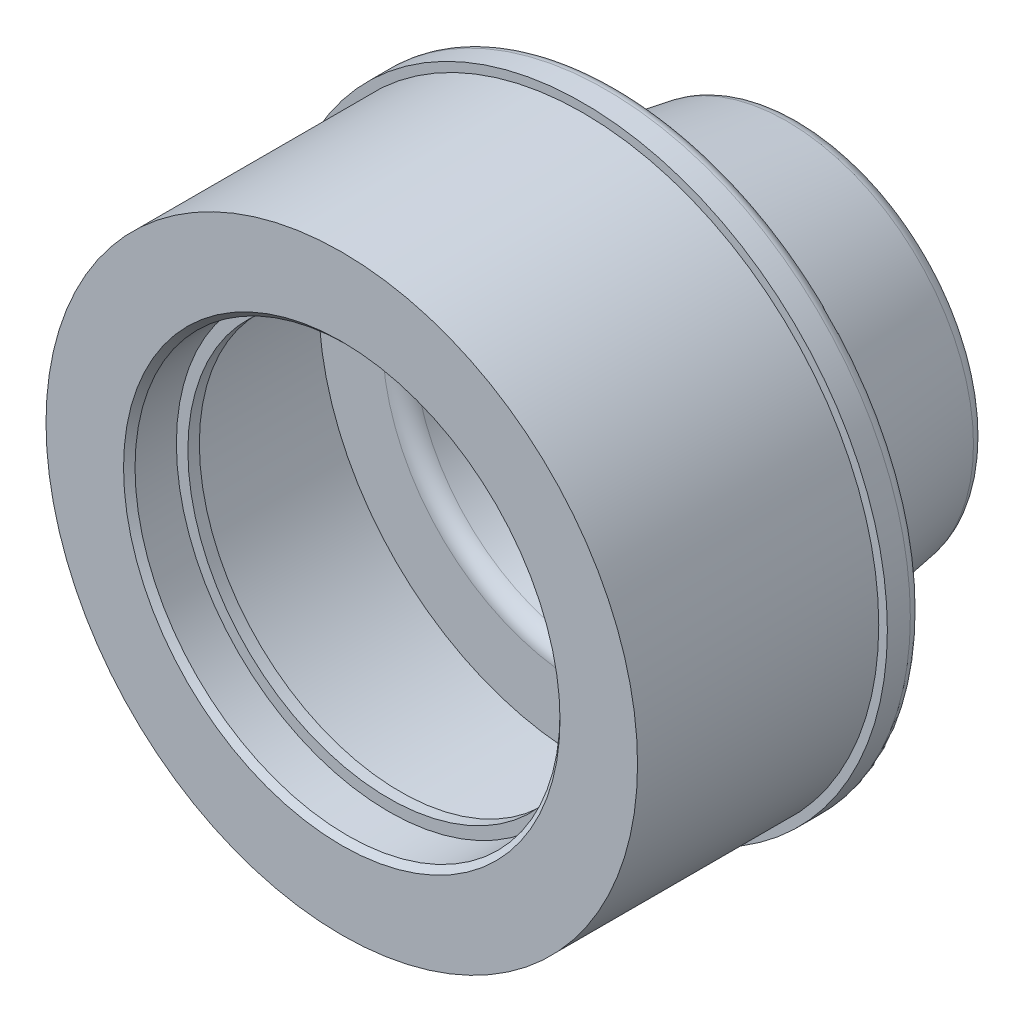
from build123d import *

# Parameters (mm, degrees)
SKETCH_3_R          = 1.675
CUT_EXTRUDE_1_DEPTH = 10
SKETCH_4_R          = 1.75
CUT_EXTRUDE_2_DEPTH = 41.749233122
FILLET_1_R          = 1.5
SKETCH_5_R          = 25.75
SKETCH_5_R_2        = 23
EXTRUDE_1_DEPTH     = 21
EXTRUDE_START       = -4.1
SKETCH_7_R          = 25.75
SKETCH_7_R_2        = 18.5
EXTRUDE_2_DEPTH     = 4.1
EXTRUDE_START_2     = 1
SKETCH_8_R          = 25.75
SKETCH_8_R_2        = 17.5
EXTRUDE_3_DEPTH     = 1
FILLET_2_R          = 1
CHAMFER_1_SIZE      = 0.5


with BuildPart() as part:
    # 草图2 → 旋转1 (revolve)
    with BuildSketch(Plane(origin=(0, 0, 0), x_dir=(0, 0, -1), z_dir=(1, 0, 0)), mode=Mode.PRIVATE) as revolve_1_sk:
        Polygon((0, 0), (3, 0), (3, 16.036165005), (-13, 18.736165005), (-13, 26.5), (-16, 26.5), (-16, 16.2), (0, 13.5), align=None)
    revolve(revolve_1_sk.sketch.rotate(Axis((0, 0, 0), (0, 0, -1)), 90), axis=Axis((0, 0, 0), (0, 0, -1)))

    # 草图3 → 切除-拉伸1 (cut)
    with BuildSketch(Plane(origin=(0, 0, -3), x_dir=(-1, 0, 0), z_dir=(0, 0, -1))):
        with Locations((5.656854249, 5.656854249)):
            Circle(SKETCH_3_R)
        with Locations((5.656854249, -5.656854249)):
            Circle(SKETCH_3_R)
        with Locations((-5.656854249, 5.656854249)):
            Circle(SKETCH_3_R)
        with Locations((-5.656854249, -5.656854249)):
            Circle(SKETCH_3_R)
    extrude(amount=-CUT_EXTRUDE_1_DEPTH, mode=Mode.SUBTRACT)

    # 草图4 → 切除-拉伸2 (cut, through all)
    with BuildSketch(Plane(origin=(0, 0, 0), x_dir=(1, 0, 0), z_dir=(0, 1, 0))):
        with Locations(Location((0, -8, 0), (0, 0, 136.407373303))):
            Circle(SKETCH_4_R)
    extrude(amount=-CUT_EXTRUDE_2_DEPTH, mode=Mode.SUBTRACT)

    # 圆角1
    fillet_1_edges = [part.edges().sort_by_distance(p)[0] for p in [
        (-13.5, 0, 0),
        (-16.2, 0, 16),
        (-18.736165005, 0, 13),
        (-16.036165005, 0, -3),
    ]]
    fillet(fillet_1_edges, radius=FILLET_1_R)

    # 草图5 → 凸台-拉伸1 (add)
    with BuildSketch(Plane.XY.offset(16)):
        with Locations(Location((0, 0, 0), (0, 0, 180))):
            Circle(SKETCH_5_R)
        with Locations(Location((0, 0, 0), (0, 0, 180))):
            Circle(SKETCH_5_R_2, mode=Mode.SUBTRACT)
    extrude(amount=EXTRUDE_1_DEPTH)

    # 草图7 → 凸台-拉伸2 (add)
    with BuildSketch(Plane.XY.offset(37).offset(EXTRUDE_START)):
        with Locations(Location((0, 0, 0), (0, 0, 180))):
            Circle(SKETCH_7_R)
        Circle(SKETCH_7_R_2, mode=Mode.SUBTRACT)
    extrude(amount=EXTRUDE_2_DEPTH)

    # 草图8 → 凸台-拉伸3 (add)
    with BuildSketch(Plane(origin=(0, 0, 32.9), x_dir=(-1, 0, 0), z_dir=(0, 0, -1)).offset(EXTRUDE_START_2)):
        Circle(SKETCH_8_R)
        Circle(SKETCH_8_R_2, mode=Mode.SUBTRACT)
    extrude(amount=-EXTRUDE_3_DEPTH)

    # 圆角2
    fillet_2_edges = [part.edges().sort_by_distance(p)[0] for p in [
        (-26.5, 0, 13),
    ]]
    fillet(fillet_2_edges, radius=FILLET_2_R)

    # 倒角1
    chamfer_1_edges = [part.edges().sort_by_distance(p)[0] for p in [
        (-18.5, 0, 37),
    ]]
    chamfer(chamfer_1_edges, length=CHAMFER_1_SIZE)


solid = part.part
